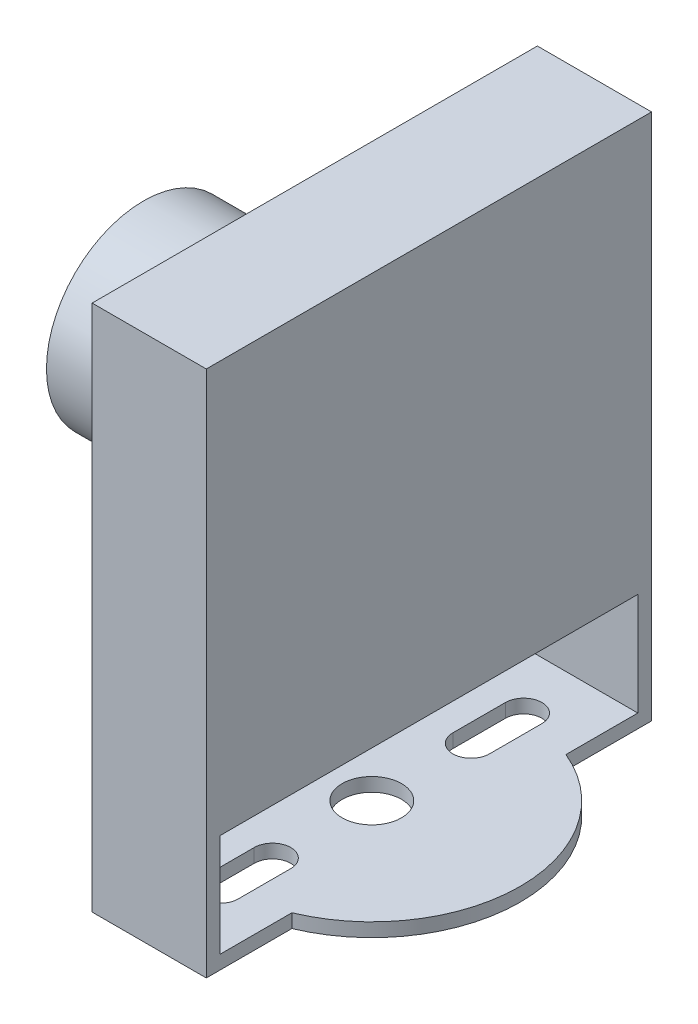
from build123d import *

# Parameters (mm, degrees)
SKETCH_1_R          = 13
EXTRUDE_1_DEPTH     = 1.2
SKETCH_2_W          = 10
SKETCH_2_H          = 39
EXTRUDE_2_DEPTH     = 1.2
SKETCH_3_W          = 10
SKETCH_3_H          = 1.2
EXTRUDE_3_DEPTH     = 45
SKETCH_4_W          = 10
SKETCH_4_H          = 36
EXTRUDE_4_DEPTH     = 36.6
SKETCH_5_W          = 25
SKETCH_5_H          = 25
EXTRUDE_5_DEPTH     = 3
SKETCH_6_R          = 8.5
EXTRUDE_6_DEPTH     = 12
CUT_EXTRUDE_1_REACH = 55.988
SKETCH_7_R          = 2.6


with BuildPart() as part:
    # 草图1 → 凸台-拉伸1 (new body)
    with BuildSketch(Plane(origin=(0, 0, 0), x_dir=(1, 0, 0), z_dir=(0, 1, 0))):
        with Locations(Location((0, 0, 0), (0, 0, 270))):
            Circle(SKETCH_1_R)
    extrude(amount=EXTRUDE_1_DEPTH)

    # 草图2 → 凸台-拉伸2 (add)
    with BuildSketch(Plane(origin=(0, 1.2, 0), x_dir=(1, 0, 0), z_dir=(0, 1, 0))):
        Rectangle(SKETCH_2_W, SKETCH_2_H)
    extrude(amount=-EXTRUDE_2_DEPTH)

    # 草图3 → 凸台-拉伸3 (add)
    with BuildSketch(Plane(origin=(0, 1.2, 0), x_dir=(1, 0, 0), z_dir=(0, 1, 0))):
        with Locations((0, 18.9)):
            Rectangle(SKETCH_3_W, SKETCH_3_H)
    extrude_3 = extrude(amount=EXTRUDE_3_DEPTH)

    # 镜向1: 凸台-拉伸3 across plane
    add(extrude_3.mirror(Plane.XY))

    # 草图4 → 凸台-拉伸4 (add)
    with BuildSketch(Plane.XY.offset(-18.3)):
        with Locations((0, 28.2)):
            Rectangle(SKETCH_4_W, SKETCH_4_H)
    extrude(amount=EXTRUDE_4_DEPTH)

    # 草图5 → 凸台-拉伸5 (add)
    with BuildSketch(Plane.ZY.offset(5)):
        with Locations((0, 28.2)):
            Rectangle(SKETCH_5_W, SKETCH_5_H)
    extrude(amount=EXTRUDE_5_DEPTH)

    # 草图6 → 凸台-拉伸6 (add)
    with BuildSketch(Plane.ZY.offset(8)):
        with Locations((0, 28.2)):
            Circle(SKETCH_6_R)
    extrude(amount=EXTRUDE_6_DEPTH)

    # 草图7 → 切除-拉伸1 (cut, up to next)
    with BuildSketch(Plane.XZ, mode=Mode.PRIVATE) as cut_extrude_1_sk1:
        with Locations(Location((0, 0, 0), (0, 0, 270))):
            Circle(SKETCH_7_R)
    cut_extrude_1_tool1 = extrude(cut_extrude_1_sk1.sketch, amount=-CUT_EXTRUDE_1_REACH, mode=Mode.PRIVATE) & part.part
    # 草图7 → 切除-拉伸1 (cut, up to next)
    with BuildSketch(Plane.XZ, mode=Mode.PRIVATE) as cut_extrude_1_sk2:
        with BuildLine():
            Line((-1.6, 8.7), (-1.6, 13.3))
            ThreePointArc((-1.6, 13.3), (0, 14.9), (1.6, 13.3))
            Line((1.6, 13.3), (1.6, 8.7))
            ThreePointArc((1.6, 8.7), (0, 7.1), (-1.6, 8.7))
        make_face()
    cut_extrude_1_tool2 = extrude(cut_extrude_1_sk2.sketch, amount=-CUT_EXTRUDE_1_REACH, mode=Mode.PRIVATE) & part.part
    # 草图7 → 切除-拉伸1 (cut, up to next)
    with BuildSketch(Plane.XZ, mode=Mode.PRIVATE) as cut_extrude_1_sk3:
        with BuildLine():
            Line((-1.6, -8.7), (-1.6, -13.3))
            ThreePointArc((-1.6, -13.3), (0, -14.9), (1.6, -13.3))
            Line((1.6, -13.3), (1.6, -8.7))
            ThreePointArc((1.6, -8.7), (0, -7.1), (-1.6, -8.7))
        make_face()
    cut_extrude_1_tool3 = extrude(cut_extrude_1_sk3.sketch, amount=-CUT_EXTRUDE_1_REACH, mode=Mode.PRIVATE) & part.part
    add(cut_extrude_1_tool1.solids().sort_by_distance((0, 0, 0))[0], mode=Mode.SUBTRACT)
    add(cut_extrude_1_tool2.solids().sort_by_distance((0, 0, 11))[0], mode=Mode.SUBTRACT)
    add(cut_extrude_1_tool3.solids().sort_by_distance((0, 0, -11))[0], mode=Mode.SUBTRACT)


solid = part.part
